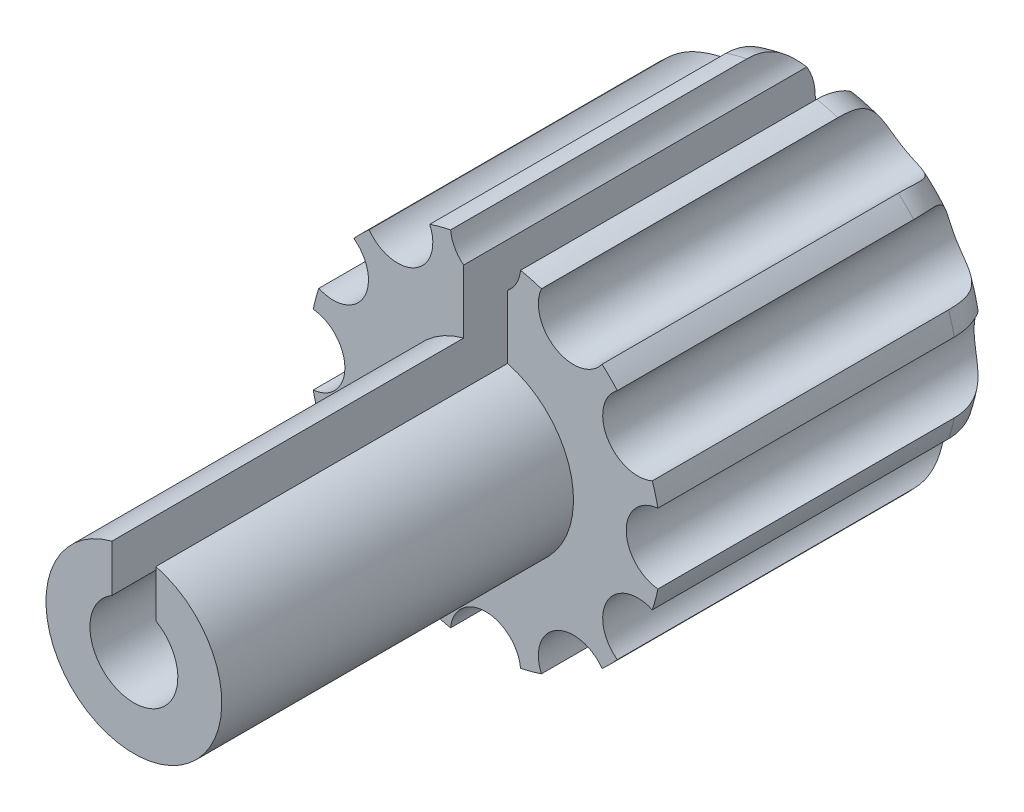
from build123d import *

# Parameters (mm, degrees)
CROQUIS1_R              = 6.35
SALIENTE_EXTRUIR1_DEPTH = 12.7
REDONDEO2_R             = 2
CROQUIS2_R              = 1.27
CORTAR_EXTRUIR1_DEPTH   = 12.7
CROQUIS4_R              = 3.175
SALIENTE_EXTRUIR2_DEPTH = 12.7
CROQUIS3_R              = 1.5875
CORTAR_EXTRUIR2_DEPTH   = 27.881433379
CROQUIS5_W              = 1.5875
CROQUIS5_H              = 31.254771719
CORTAR_EXTRUIR3_DEPTH   = 12.7


with BuildPart() as part:
    # Croquis1 → Saliente-Extruir1 (new body)
    with BuildSketch(Plane.XY):
        Circle(CROQUIS1_R)
    extrude(amount=SALIENTE_EXTRUIR1_DEPTH)

    # Redondeo2
    redondeo2_edges = [part.edges().sort_by_distance(p)[0] for p in [
        (-6.35, 0, 0),
    ]]
    fillet(redondeo2_edges, radius=REDONDEO2_R)

    # Croquis2 → Cortar-Extruir1 (cut)
    with BuildSketch(Plane.XY.offset(12.7)):
        with Locations((-6.35, 0)):
            Circle(CROQUIS2_R)
        with Locations((-5.499261314, 3.175)):
            Circle(CROQUIS2_R)
        with Locations((-3.175, 5.499261314)):
            Circle(CROQUIS2_R)
        with Locations((0, 6.35)):
            Circle(CROQUIS2_R)
        with Locations((3.175, 5.499261314)):
            Circle(CROQUIS2_R)
        with Locations((5.499261314, 3.175)):
            Circle(CROQUIS2_R)
        with Locations((6.35, 0)):
            Circle(CROQUIS2_R)
        with Locations((5.499261314, -3.175)):
            Circle(CROQUIS2_R)
        with Locations((3.175, -5.499261314)):
            Circle(CROQUIS2_R)
        with Locations((0, -6.35)):
            Circle(CROQUIS2_R)
        with Locations((-3.175, -5.499261314)):
            Circle(CROQUIS2_R)
        with Locations((-5.499261314, -3.175)):
            Circle(CROQUIS2_R)
    extrude(amount=-CORTAR_EXTRUIR1_DEPTH, mode=Mode.SUBTRACT)

    # Croquis4 → Saliente-Extruir2 (add)
    with BuildSketch(Plane.XY.offset(12.7)):
        Circle(CROQUIS4_R)
    extrude(amount=SALIENTE_EXTRUIR2_DEPTH)

    # Croquis3 → Cortar-Extruir2 (cut, through all)
    with BuildSketch(Plane(origin=(0, 0, 0), x_dir=(-1, 0, 0), z_dir=(0, 0, -1))):
        Circle(CROQUIS3_R)
    extrude(amount=-CORTAR_EXTRUIR2_DEPTH, mode=Mode.SUBTRACT)

    # Croquis5 → Cortar-Extruir3 (cut)
    with BuildSketch(Plane(origin=(0, 0, 0), x_dir=(1, 0, 0), z_dir=(0, 1, 0))):
        with Locations((0, -15.62738586)):
            Rectangle(CROQUIS5_W, CROQUIS5_H)
    extrude(amount=CORTAR_EXTRUIR3_DEPTH, mode=Mode.SUBTRACT)


solid = part.part
